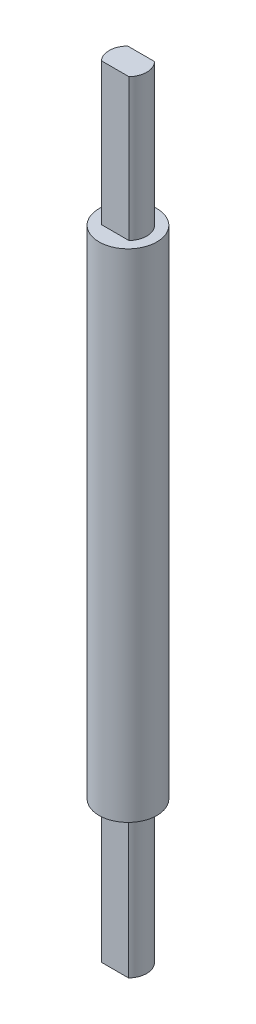
from build123d import *

# Parameters (mm, degrees)
BOSS_EXTRUDE1_DEPTH = 20
SKETCH2_R           = 4.075
BOSS_EXTRUDE2_DEPTH = 70
BOSS_EXTRUDE3_DEPTH = 20


with BuildPart() as part:
    # Sketch1 → Boss-Extrude1 (new body)
    with BuildSketch(Plane(origin=(0, 0, 0), x_dir=(1, 0, 0), z_dir=(0, 1, 0))):
        with BuildLine():
            Line((1.907609761, 1.825), (-1.907609761, 1.825))
            ThreePointArc((-1.907609761, 1.825), (-2.64, 0), (-1.907609761, -1.825))
            Line((-1.907609761, -1.825), (1.907609761, -1.825))
            ThreePointArc((1.907609761, -1.825), (2.64, 0), (1.907609761, 1.825))
        make_face()
    extrude(amount=BOSS_EXTRUDE1_DEPTH)

    # Sketch2 → Boss-Extrude2 (add)
    with BuildSketch(Plane(origin=(0, 20, 0), x_dir=(1, 0, 0), z_dir=(0, 1, 0))):
        with Locations(Location((0, 0, 0), (0, 0, 270))):
            Circle(SKETCH2_R)
    extrude(amount=BOSS_EXTRUDE2_DEPTH)

    # Sketch3 → Boss-Extrude3 (add)
    with BuildSketch(Plane(origin=(0, 90, 0), x_dir=(1, 0, 0), z_dir=(0, 1, 0))):
        with BuildLine():
            Line((1.897366596, 1.85), (-1.897366596, 1.85))
            ThreePointArc((-1.897366596, 1.85), (-2.649775646, 0.034482248), (-1.944865034, -1.8))
            Line((-1.944865034, -1.8), (1.944865034, -1.8))
            ThreePointArc((1.944865034, -1.8), (2.649775646, 0.034482248), (1.897366596, 1.85))
        make_face()
    extrude(amount=BOSS_EXTRUDE3_DEPTH)


solid = part.part
